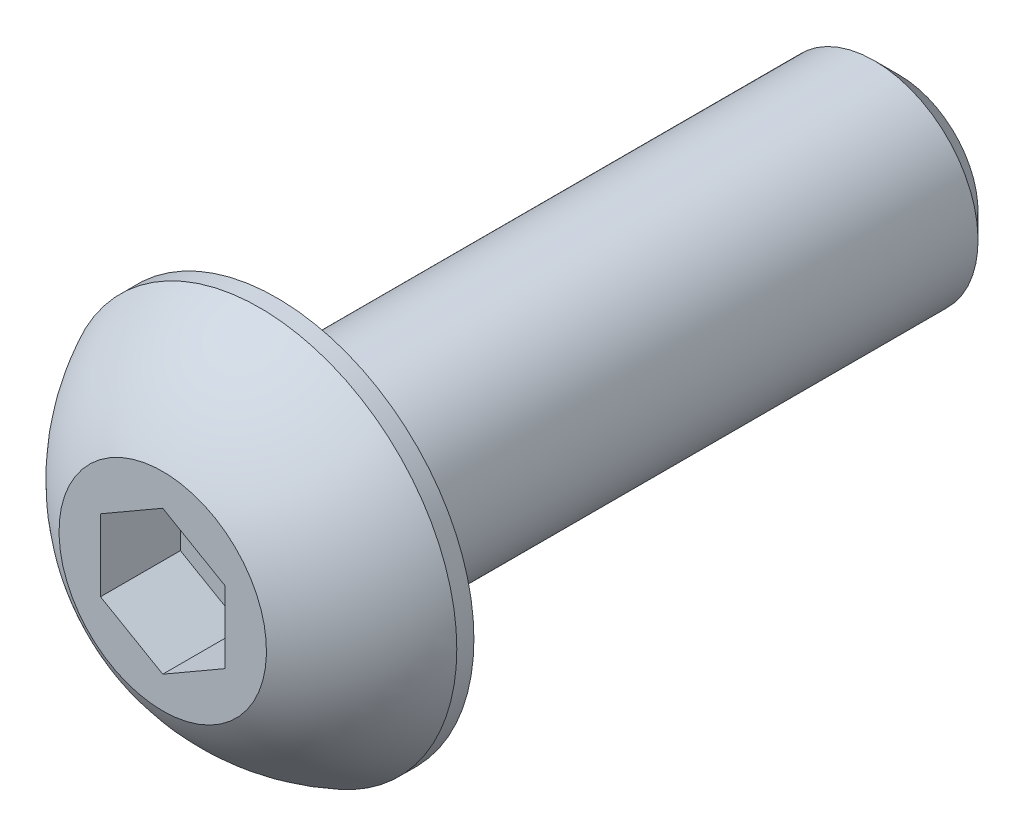
from build123d import *

# Parameters (mm, degrees)
SKETCH1_W          = 15
SKETCH1_H          = 2.5
CHAMFER1_SIZE      = 0.6
CUT_EXTRUDE2_DEPTH = 1.925


with BuildPart() as part:
    # Sketch1 → Revolve1 (revolve)
    with BuildSketch(Plane(origin=(0, 0, 0), x_dir=(0, 0, -1), z_dir=(1, 0, 0))):
        with Locations((10.25, 1.25)):
            Rectangle(SKETCH1_W, SKETCH1_H)
    revolve(axis=Axis((0, 0, -17.75), (0, 0, 1)))

    # Chamfer1
    chamfer1_edges = [part.edges().sort_by_distance(p)[0] for p in [
        (0, -2.5, -17.75),
    ]]
    chamfer(chamfer1_edges, length=CHAMFER1_SIZE)

    # Sketch7 → Revolve2 (revolve)
    with BuildSketch(Plane(origin=(0, 0, 0), x_dir=(0, 0, -1), z_dir=(1, 0, 0))):
        with BuildLine():
            Line((2.3375, 4.75), (2.75, 4.75))
            Line((2.75, 4.75), (2.75, 0))
            Line((2.75, 0), (0, 0))
            Line((0, 0), (0, 2.5))
            ThreePointArc((0, 2.5), (0.991875183, 3.808753282), (2.3375, 4.75))
        make_face()
    revolve(axis=Axis((0, 0, 0), (0, 0, -1)))

    # Sketch5 → Cut-Extrude2 (cut)
    with BuildSketch(Plane.XY):
        Polygon((1.5, -0.866025404), (1.5, 0.866025404), (0, 1.732050808), (-1.5, 0.866025404), (-1.5, -0.866025404), (0, -1.732050808), align=None)
    extrude(amount=-CUT_EXTRUDE2_DEPTH, mode=Mode.SUBTRACT)


solid = part.part
